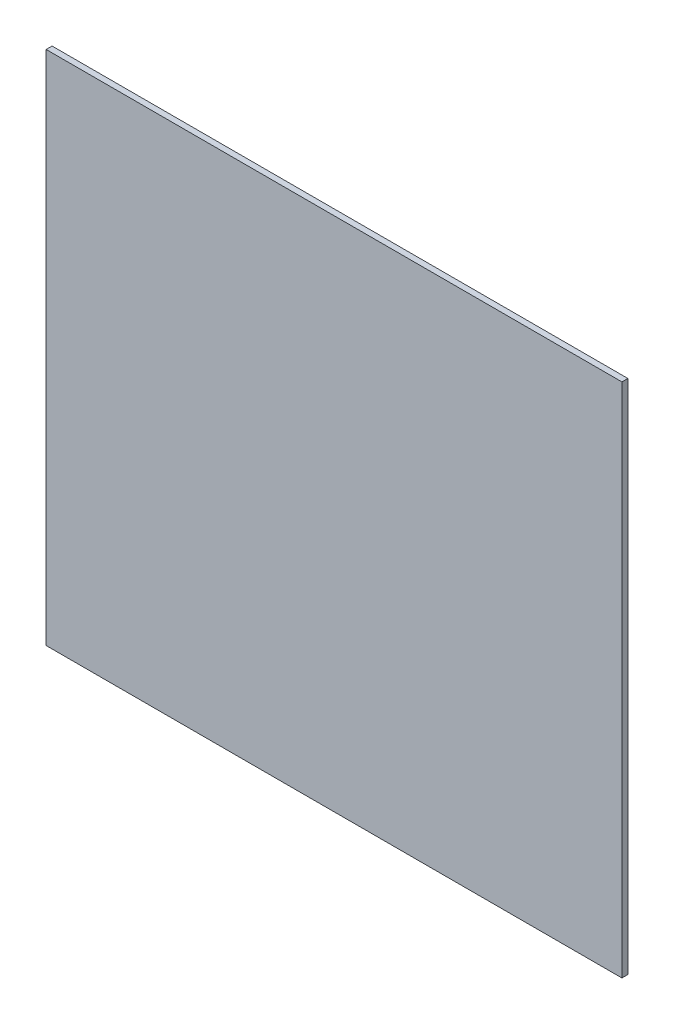
from build123d import *

# Parameters (mm, degrees)
SKETCH_1_W      = 290
SKETCH_1_H      = 260
EXTRUDE_1_DEPTH = 3


with BuildPart() as part:
    # Эскиз1 → Бобышка-Вытянуть1 (new body)
    with BuildSketch(Plane.XY):
        Rectangle(SKETCH_1_W, SKETCH_1_H)
    extrude(amount=EXTRUDE_1_DEPTH)


solid = part.part
